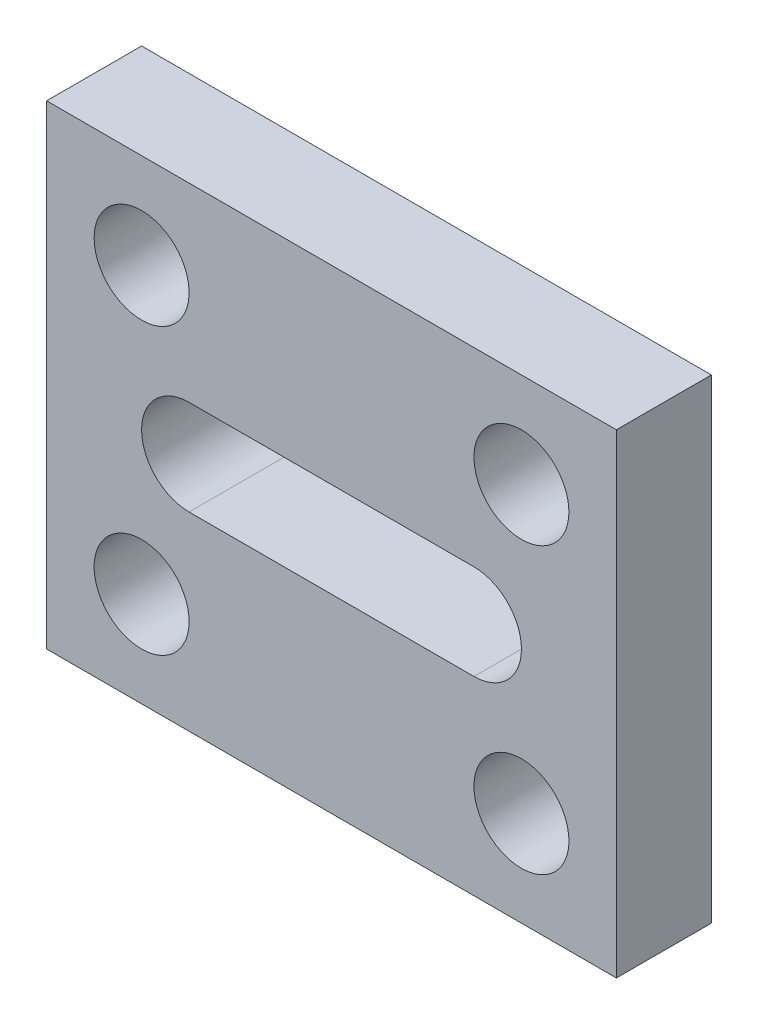
from build123d import *

# Parameters (mm, degrees)
SKETCH2_W           = 120
SKETCH2_H           = 100
SKETCH2_R           = 10
BOSS_EXTRUDE1_DEPTH = 20


with BuildPart() as part:
    # Sketch2 → Boss-Extrude1 (new body)
    with BuildSketch(Plane.XY):
        Rectangle(SKETCH2_W, SKETCH2_H)
        with Locations((-40, -30)):
            Circle(SKETCH2_R, mode=Mode.SUBTRACT)
        with Locations(Location((40, -30, 0), (0, 0, 180))):
            Circle(SKETCH2_R, mode=Mode.SUBTRACT)
        with Locations((40, 30)):
            Circle(SKETCH2_R, mode=Mode.SUBTRACT)
        with Locations(Location((-40, 30, 0), (0, 0, 180))):
            Circle(SKETCH2_R, mode=Mode.SUBTRACT)
        with BuildLine():
            Line((-30, 10), (30, 10))
            ThreePointArc((30, 10), (40, 0), (30, -10))
            Line((30, -10), (-30, -10))
            ThreePointArc((-30, -10), (-40, 0), (-30, 10))
        make_face(mode=Mode.SUBTRACT)
    extrude(amount=BOSS_EXTRUDE1_DEPTH)


solid = part.part
